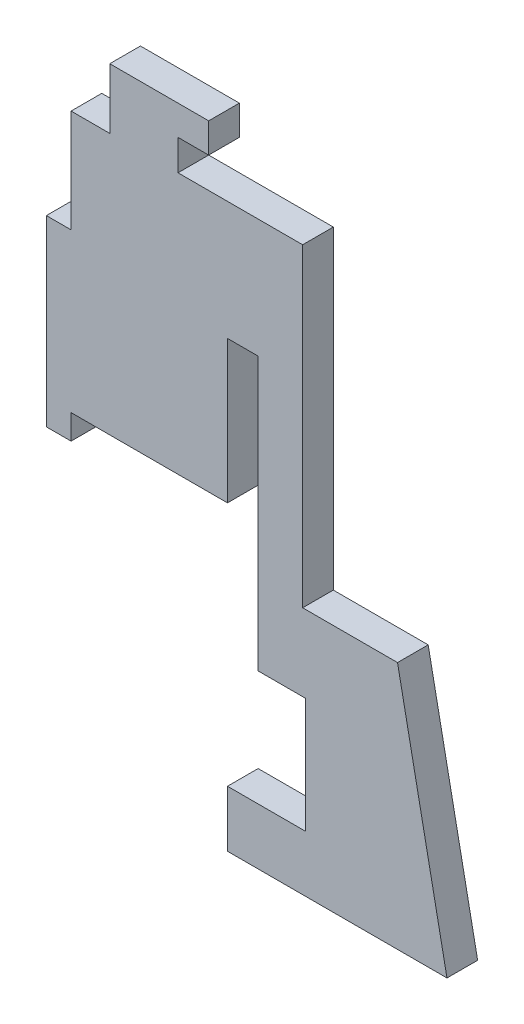
from build123d import *

# Parameters (mm, degrees)
BOSS_EXTRUDE1_DEPTH      = 1.55
BOSS_EXTRUDE1_DEPTH_BACK = 1.55


with BuildPart() as part:
    # Sketch1 → Boss-Extrude1 (new, two sides: drawn at the far end of the back side and taken through both)
    with BuildSketch(Plane.XY.offset(-BOSS_EXTRUDE1_DEPTH_BACK)):
        Polygon((-72.5, 31.1), (-70, 31.1), (-70, 33.6), (-54.19, 33.6), (-54.19, 48), (-51.09, 48), (-51.09, 20.43683659), (-46.319540472, 20.43683659), (-46.319540472, 8.793397686), (-54.19, 8.793397686), (-54.19, 3.1), (-32, 3.1), (-37, 28.21655276), (-46.59, 28.21655276), (-46.59, 60), (-59.19, 60), (-59.19, 63.1), (-56.09, 63.1), (-56.09, 66.1), (-66.09, 66.1), (-66.09, 60), (-70, 60), (-70, 49.6), (-72.5, 49.6), align=None)
    extrude(amount=BOSS_EXTRUDE1_DEPTH + BOSS_EXTRUDE1_DEPTH_BACK)


solid = part.part
